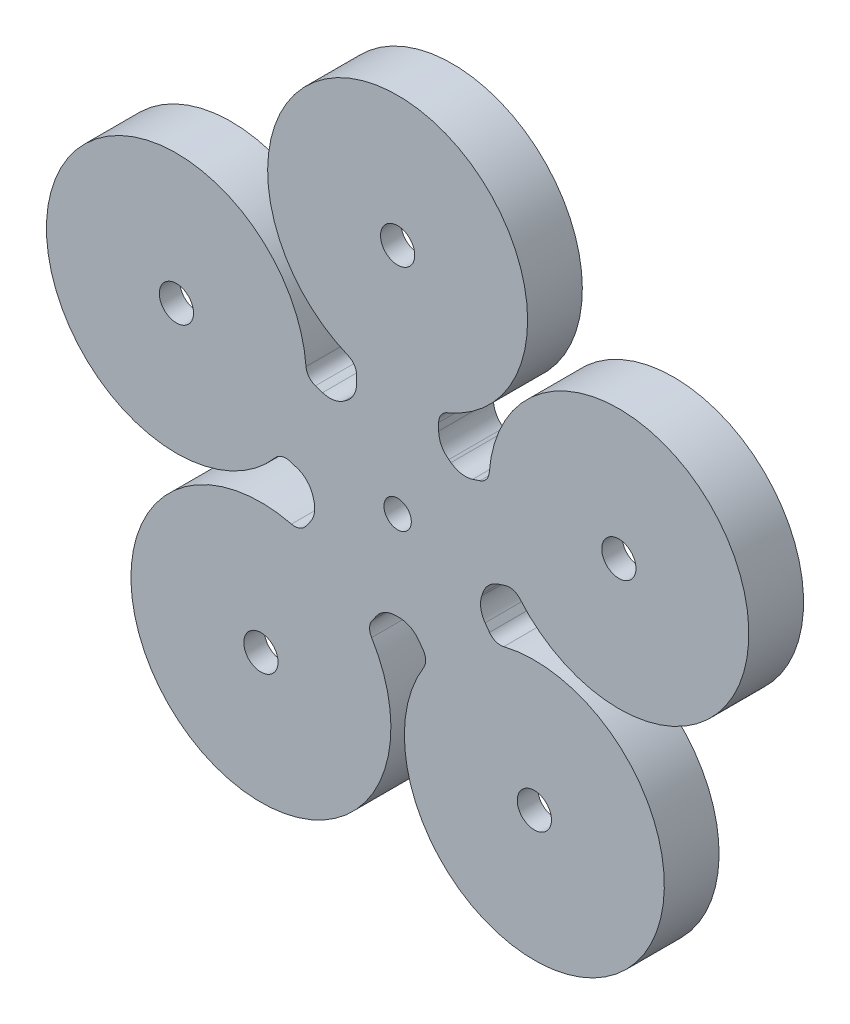
from build123d import *

# Parameters (mm, degrees)
SKETCH1_R               = 13
BOSS_EXTRUDE1_DEPTH     = 120
CUT_EXTRUDE3_DEPTH      = 53
CUT_EXTRUDE3_DEPTH_BACK = 110
SKETCH2_2_R             = 55
BOSS_EXTRUDE3_DEPTH     = 3
CUT_EXTRUDE4_DEPTH      = 75.460572398
BOSS_EXTRUDE4_DEPTH     = 5
CUT_EXTRUDE5_DEPTH      = 75.218440039
CUT_EXTRUDE5_DEPTH_BACK = 75.218440039
SKETCH8_R               = 2
SKETCH8_R_2             = 2.5


with BuildPart() as part:
    # Sketch1 → Boss-Extrude1 (new body)
    with BuildSketch(Plane.XY):
        with BuildLine():
            Line((8.145449953, 5.801003797), (16.461844151, 8.503164074))
            ThreePointArc((16.461844151, 8.503164074), (47.552825815, 15.450849719), (18.315946117, 2.796824976))
            Line((18.315946117, 2.796824976), (9.99955192, 0.094664699))
            ThreePointArc((9.99955192, 0.094664699), (9.510565163, -3.090169944), (8.034164925, -5.954174499))
            Line((8.034164925, -5.954174499), (13.173979203, -13.028521945))
            ThreePointArc((13.173979203, -13.028521945), (29.389262615, -40.450849719), (8.319877236, -16.555233459))
            Line((8.319877236, -16.555233459), (3.180062959, -9.480886012))
            ThreePointArc((3.180062959, -9.480886012), (0, -10), (-3.180062959, -9.480886012))
            Line((-3.180062959, -9.480886012), (-8.319877236, -16.555233459))
            ThreePointArc((-8.319877236, -16.555233459), (-29.389262615, -40.450849719), (-13.173979203, -13.028521945))
            Line((-13.173979203, -13.028521945), (-8.034164925, -5.954174499))
            ThreePointArc((-8.034164925, -5.954174499), (-9.510565163, -3.090169944), (-9.99955192, 0.094664699))
            Line((-9.99955192, 0.094664699), (-18.315946117, 2.796824976))
            ThreePointArc((-18.315946117, 2.796824976), (-47.552825815, 15.450849719), (-16.461844151, 8.503164074))
            Line((-16.461844151, 8.503164074), (-8.145449953, 5.801003797))
            ThreePointArc((-8.145449953, 5.801003797), (-5.877852523, 8.090169944), (-3, 9.539392014))
            Line((-3, 9.539392014), (-3, 18.283766354))
            ThreePointArc((-3, 18.283766354), (0, 50), (3, 18.283766354))
            Line((3, 18.283766354), (3, 9.539392014))
            ThreePointArc((3, 9.539392014), (5.877852523, 8.090169944), (8.145449953, 5.801003797))
        make_face()
        with Locations((0, 34)):
            Circle(SKETCH1_R, mode=Mode.SUBTRACT)
        with Locations((32.335921554, 10.506577809)):
            Circle(SKETCH1_R, mode=Mode.SUBTRACT)
        with Locations((19.984698578, -27.506577809)):
            Circle(SKETCH1_R, mode=Mode.SUBTRACT)
        with Locations((-19.984698578, -27.506577809)):
            Circle(SKETCH1_R, mode=Mode.SUBTRACT)
        with Locations((-32.335921554, 10.506577809)):
            Circle(SKETCH1_R, mode=Mode.SUBTRACT)
    extrude(amount=BOSS_EXTRUDE1_DEPTH)

    # Sketch2<2> → Cut-Extrude3 (cut, two sides: drawn at the far end of the back side and taken through both)
    with BuildSketch(Plane(origin=(0, 0, 0), x_dir=(-1, 0, 0), z_dir=(0, 0, -1)).offset(-CUT_EXTRUDE3_DEPTH_BACK)):
        Circle(SKETCH2_2_R)
    extrude(amount=CUT_EXTRUDE3_DEPTH + CUT_EXTRUDE3_DEPTH_BACK, mode=Mode.SUBTRACT)

    # Sketch6 → Boss-Extrude3 (add)
    with BuildSketch(Plane(origin=(0, 0, 110), x_dir=(-1, 0, 0), z_dir=(0, 0, -1))):
        with BuildLine():
            Line((-15.723846237, -1.199786002), (-14.684555835, -1.537471924))
            ThreePointArc((-14.684555835, -1.537471924), (-13.273010033, -2.409662852), (-12.421787824, -3.833951909))
            ThreePointArc((-12.421787824, -3.833951909), (-12.363734712, -4.017220927), (-12.302977841, -4.19961144))
            ThreePointArc((-12.302977841, -4.19961144), (-12.15445497, -5.852221353), (-12.783758548, -7.387524442))
            Line((-12.783758548, -7.387524442), (-13.426075341, -8.271597662))
            ThreePointArc((-13.426075341, -8.271597662), (-14.353632706, -8.973057267), (-15.514641639, -9.039889124))
            ThreePointArc((-15.514641639, -9.039889124), (-31.152618372, -42.877900702), (-3.80315753, -17.548780396))
            ThreePointArc((-3.80315753, -17.548780396), (-4.098368148, -16.423943104), (-3.717871409, -15.32502069))
            Line((-3.717871409, -15.32502069), (-3.075554616, -14.440947469))
            ThreePointArc((-3.075554616, -14.440947469), (-1.809860109, -13.368009454), (-0.192238592, -12.99857855))
            ThreePointArc((-0.192238592, -12.99857855), (0, -13), (0.192238592, -12.99857855))
            ThreePointArc((0.192238592, -12.99857855), (1.809860109, -13.368009454), (3.075554616, -14.440947469))
            Line((3.075554616, -14.440947469), (3.717871409, -15.32502069))
            ThreePointArc((3.717871409, -15.32502069), (4.098368148, -16.423943104), (3.80315753, -17.548780396))
            ThreePointArc((3.80315753, -17.548780396), (31.152618372, -42.877900702), (15.514641639, -9.039889124))
            ThreePointArc((15.514641639, -9.039889124), (14.353632706, -8.973057267), (13.426075341, -8.271597662))
            Line((13.426075341, -8.271597662), (12.783758548, -7.387524442))
            ThreePointArc((12.783758548, -7.387524442), (12.15445497, -5.852221353), (12.302977841, -4.19961144))
            ThreePointArc((12.302977841, -4.19961144), (12.363734712, -4.017220927), (12.421787824, -3.833951909))
            ThreePointArc((12.421787824, -3.833951909), (13.273010033, -2.409662852), (14.684555835, -1.537471924))
            Line((14.684555835, -1.537471924), (15.723846237, -1.199786002))
            ThreePointArc((15.723846237, -1.199786002), (16.886563519, -1.177497801), (17.865122257, -1.805853621))
            ThreePointArc((17.865122257, -1.805853621), (50.405995364, 16.377900702), (13.391733387, 11.961821662))
            ThreePointArc((13.391733387, 11.961821662), (12.969401022, 10.87828873), (12.015642305, 10.212892193))
            Line((12.015642305, 10.212892193), (10.976351903, 9.875206271))
            ThreePointArc((10.976351903, 9.875206271), (9.321726396, 9.751137749), (7.79589706, 10.403075941))
            ThreePointArc((7.79589706, 10.403075941), (7.64120828, 10.517220927), (7.484848485, 10.629065959))
            ThreePointArc((7.484848485, 10.629065959), (6.393311224, 11.878755911), (6, 13.490737563))
            Line((6, 13.490737563), (6, 14.583512161))
            ThreePointArc((6, 14.583512161), (6.33810206, 15.696209442), (7.238095238, 16.432701479))
            ThreePointArc((7.238095238, 16.432701479), (0, 53), (-7.238095238, 16.432701479))
            ThreePointArc((-7.238095238, 16.432701479), (-6.33810206, 15.696209442), (-6, 14.583512161))
            Line((-6, 14.583512161), (-6, 13.490737563))
            ThreePointArc((-6, 13.490737563), (-6.393311224, 11.878755911), (-7.484848485, 10.629065959))
            ThreePointArc((-7.484848485, 10.629065959), (-7.64120828, 10.517220927), (-7.79589706, 10.403075941))
            ThreePointArc((-7.79589706, 10.403075941), (-9.321726396, 9.751137749), (-10.976351903, 9.875206271))
            Line((-10.976351903, 9.875206271), (-12.015642305, 10.212892193))
            ThreePointArc((-12.015642305, 10.212892193), (-12.969401022, 10.87828873), (-13.391733387, 11.961821662))
            ThreePointArc((-13.391733387, 11.961821662), (-50.405995364, 16.377900702), (-17.865122257, -1.805853621))
            ThreePointArc((-17.865122257, -1.805853621), (-16.886563519, -1.177497801), (-15.723846237, -1.199786002))
        make_face()
    extrude(amount=BOSS_EXTRUDE3_DEPTH)

    # Sketch6<2> → Cut-Extrude4 (cut, through all)
    with BuildSketch(Plane(origin=(0, 0, 110), x_dir=(-1, 0, 0), z_dir=(0, 0, -1))):
        with BuildLine():
            Line((-15.723846237, -1.199786002), (-14.684555835, -1.537471924))
            ThreePointArc((-14.684555835, -1.537471924), (-13.273010033, -2.409662852), (-12.421787824, -3.833951909))
            ThreePointArc((-12.421787824, -3.833951909), (-12.363734712, -4.017220927), (-12.302977841, -4.19961144))
            ThreePointArc((-12.302977841, -4.19961144), (-12.15445497, -5.852221353), (-12.783758548, -7.387524442))
            Line((-12.783758548, -7.387524442), (-13.426075341, -8.271597662))
            ThreePointArc((-13.426075341, -8.271597662), (-14.353632706, -8.973057267), (-15.514641639, -9.039889124))
            ThreePointArc((-15.514641639, -9.039889124), (-31.152618372, -42.877900702), (-3.80315753, -17.548780396))
            ThreePointArc((-3.80315753, -17.548780396), (-4.098368148, -16.423943104), (-3.717871409, -15.32502069))
            Line((-3.717871409, -15.32502069), (-3.075554616, -14.440947469))
            ThreePointArc((-3.075554616, -14.440947469), (-1.809860109, -13.368009454), (-0.192238592, -12.99857855))
            ThreePointArc((-0.192238592, -12.99857855), (0, -13), (0.192238592, -12.99857855))
            ThreePointArc((0.192238592, -12.99857855), (1.809860109, -13.368009454), (3.075554616, -14.440947469))
            Line((3.075554616, -14.440947469), (3.717871409, -15.32502069))
            ThreePointArc((3.717871409, -15.32502069), (4.098368148, -16.423943104), (3.80315753, -17.548780396))
            ThreePointArc((3.80315753, -17.548780396), (31.152618372, -42.877900702), (15.514641639, -9.039889124))
            ThreePointArc((15.514641639, -9.039889124), (14.353632706, -8.973057267), (13.426075341, -8.271597662))
            Line((13.426075341, -8.271597662), (12.783758548, -7.387524442))
            ThreePointArc((12.783758548, -7.387524442), (12.15445497, -5.852221353), (12.302977841, -4.19961144))
            ThreePointArc((12.302977841, -4.19961144), (12.363734712, -4.017220927), (12.421787824, -3.833951909))
            ThreePointArc((12.421787824, -3.833951909), (13.273010033, -2.409662852), (14.684555835, -1.537471924))
            Line((14.684555835, -1.537471924), (15.723846237, -1.199786002))
            ThreePointArc((15.723846237, -1.199786002), (16.886563519, -1.177497801), (17.865122257, -1.805853621))
            ThreePointArc((17.865122257, -1.805853621), (50.405995364, 16.377900702), (13.391733387, 11.961821662))
            ThreePointArc((13.391733387, 11.961821662), (12.969401022, 10.87828873), (12.015642305, 10.212892193))
            Line((12.015642305, 10.212892193), (10.976351903, 9.875206271))
            ThreePointArc((10.976351903, 9.875206271), (9.321726396, 9.751137749), (7.79589706, 10.403075941))
            ThreePointArc((7.79589706, 10.403075941), (7.64120828, 10.517220927), (7.484848485, 10.629065959))
            ThreePointArc((7.484848485, 10.629065959), (6.393311224, 11.878755911), (6, 13.490737563))
            Line((6, 13.490737563), (6, 14.583512161))
            ThreePointArc((6, 14.583512161), (6.33810206, 15.696209442), (7.238095238, 16.432701479))
            ThreePointArc((7.238095238, 16.432701479), (0, 53), (-7.238095238, 16.432701479))
            ThreePointArc((-7.238095238, 16.432701479), (-6.33810206, 15.696209442), (-6, 14.583512161))
            Line((-6, 14.583512161), (-6, 13.490737563))
            ThreePointArc((-6, 13.490737563), (-6.393311224, 11.878755911), (-7.484848485, 10.629065959))
            ThreePointArc((-7.484848485, 10.629065959), (-7.64120828, 10.517220927), (-7.79589706, 10.403075941))
            ThreePointArc((-7.79589706, 10.403075941), (-9.321726396, 9.751137749), (-10.976351903, 9.875206271))
            Line((-10.976351903, 9.875206271), (-12.015642305, 10.212892193))
            ThreePointArc((-12.015642305, 10.212892193), (-12.969401022, 10.87828873), (-13.391733387, 11.961821662))
            ThreePointArc((-13.391733387, 11.961821662), (-50.405995364, 16.377900702), (-17.865122257, -1.805853621))
            ThreePointArc((-17.865122257, -1.805853621), (-16.886563519, -1.177497801), (-15.723846237, -1.199786002))
        make_face()
    extrude(amount=-CUT_EXTRUDE4_DEPTH, mode=Mode.SUBTRACT)

    # Sketch7 → Boss-Extrude4 (add)
    with BuildSketch(Plane(origin=(0, 0, 107), x_dir=(-1, 0, 0), z_dir=(0, 0, -1))):
        with BuildLine():
            Line((-10.976351903, 9.875206271), (-12.015642305, 10.212892193))
            ThreePointArc((-12.015642305, 10.212892193), (-12.969401022, 10.87828873), (-13.391733387, 11.961821662))
            ThreePointArc((-13.391733387, 11.961821662), (-50.405995364, 16.377900702), (-17.865122257, -1.805853621))
            ThreePointArc((-17.865122257, -1.805853621), (-16.886563519, -1.177497801), (-15.723846237, -1.199786002))
            Line((-15.723846237, -1.199786002), (-14.684555835, -1.537471924))
            ThreePointArc((-14.684555835, -1.537471924), (-13.273010033, -2.409662852), (-12.421787824, -3.833951909))
            ThreePointArc((-12.421787824, -3.833951909), (-12.363734712, -4.017220927), (-12.302977841, -4.19961144))
            ThreePointArc((-12.302977841, -4.19961144), (-12.15445497, -5.852221353), (-12.783758548, -7.387524442))
            Line((-12.783758548, -7.387524442), (-13.426075341, -8.271597662))
            ThreePointArc((-13.426075341, -8.271597662), (-14.353632706, -8.973057267), (-15.514641639, -9.039889124))
            ThreePointArc((-15.514641639, -9.039889124), (-31.152618372, -42.877900702), (-3.80315753, -17.548780396))
            ThreePointArc((-3.80315753, -17.548780396), (-4.098368148, -16.423943104), (-3.717871409, -15.32502069))
            Line((-3.717871409, -15.32502069), (-3.075554616, -14.440947469))
            ThreePointArc((-3.075554616, -14.440947469), (-1.809860109, -13.368009454), (-0.192238592, -12.99857855))
            ThreePointArc((-0.192238592, -12.99857855), (0, -13), (0.192238592, -12.99857855))
            ThreePointArc((0.192238592, -12.99857855), (1.809860109, -13.368009454), (3.075554616, -14.440947469))
            Line((3.075554616, -14.440947469), (3.717871409, -15.32502069))
            ThreePointArc((3.717871409, -15.32502069), (4.098368148, -16.423943104), (3.80315753, -17.548780396))
            ThreePointArc((3.80315753, -17.548780396), (31.152618372, -42.877900702), (15.514641639, -9.039889124))
            ThreePointArc((15.514641639, -9.039889124), (14.353632706, -8.973057267), (13.426075341, -8.271597662))
            Line((13.426075341, -8.271597662), (12.783758548, -7.387524442))
            ThreePointArc((12.783758548, -7.387524442), (12.15445497, -5.852221353), (12.302977841, -4.19961144))
            ThreePointArc((12.302977841, -4.19961144), (12.363734712, -4.017220927), (12.421787824, -3.833951909))
            ThreePointArc((12.421787824, -3.833951909), (13.273010033, -2.409662852), (14.684555835, -1.537471924))
            Line((14.684555835, -1.537471924), (15.723846237, -1.199786002))
            ThreePointArc((15.723846237, -1.199786002), (16.886563519, -1.177497801), (17.865122257, -1.805853621))
            ThreePointArc((17.865122257, -1.805853621), (50.405995364, 16.377900702), (13.391733387, 11.961821662))
            ThreePointArc((13.391733387, 11.961821662), (12.969401022, 10.87828873), (12.015642305, 10.212892193))
            Line((12.015642305, 10.212892193), (10.976351903, 9.875206271))
            ThreePointArc((10.976351903, 9.875206271), (9.321726396, 9.751137749), (7.79589706, 10.403075941))
            ThreePointArc((7.79589706, 10.403075941), (7.64120828, 10.517220927), (7.484848485, 10.629065959))
            ThreePointArc((7.484848485, 10.629065959), (6.393311224, 11.878755911), (6, 13.490737563))
            Line((6, 13.490737563), (6, 14.583512161))
            ThreePointArc((6, 14.583512161), (6.33810206, 15.696209442), (7.238095238, 16.432701479))
            ThreePointArc((7.238095238, 16.432701479), (0, 53), (-7.238095238, 16.432701479))
            ThreePointArc((-7.238095238, 16.432701479), (-6.33810206, 15.696209442), (-6, 14.583512161))
            Line((-6, 14.583512161), (-6, 13.490737563))
            ThreePointArc((-6, 13.490737563), (-6.393311224, 11.878755911), (-7.484848485, 10.629065959))
            ThreePointArc((-7.484848485, 10.629065959), (-7.64120828, 10.517220927), (-7.79589706, 10.403075941))
            ThreePointArc((-7.79589706, 10.403075941), (-9.321726396, 9.751137749), (-10.976351903, 9.875206271))
        make_face()
        with BuildLine():
            Line((-6.144922392, -13.561664933), (-5.502605599, -12.677591712))
            ThreePointArc((-5.502605599, -12.677591712), (-3.152030087, -10.684992542), (-0.14787584, -9.998906577))
            ThreePointArc((-0.14787584, -9.998906577), (0, -10), (0.14787584, -9.998906577))
            ThreePointArc((0.14787584, -9.998906577), (3.152030087, -10.684992542), (5.502605599, -12.677591712))
            Line((5.502605599, -12.677591712), (6.144922392, -13.561664933))
            ThreePointArc((6.144922392, -13.561664933), (7.09616424, -16.308970969), (6.358137696, -19.121064198))
            ThreePointArc((6.358137696, -19.121064198), (29.389262615, -40.450849719), (16.220440103, -11.955682075))
            ThreePointArc((16.220440103, -11.955682075), (13.317917769, -11.788602431), (10.999024358, -10.034953419))
            Line((10.999024358, -10.034953419), (10.356707565, -9.150880198))
            ThreePointArc((10.356707565, -9.150880198), (9.18800092, -6.299603034), (9.463829108, -3.230470339))
            ThreePointArc((9.463829108, -3.230470339), (9.510565163, -3.090169944), (9.555221403, -2.949193776))
            ThreePointArc((9.555221403, -2.949193776), (11.136062647, -0.304085527), (13.757504852, 1.315697625))
            Line((13.757504852, 1.315697625), (14.796795254, 1.653383547))
            ThreePointArc((14.796795254, 1.653383547), (17.703588459, 1.709104051), (20.149985304, 0.138214499))
            ThreePointArc((20.149985304, 0.138214499), (47.552825815, 15.450849719), (16.382920992, 11.732046317))
            ThreePointArc((16.382920992, 11.732046317), (15.32709008, 9.023213987), (12.942693288, 7.359722644))
            Line((12.942693288, 7.359722644), (11.903402886, 7.022036723))
            ThreePointArc((11.903402886, 7.022036723), (8.830526944, 6.791623752), (5.996843892, 8.002366108))
            ThreePointArc((5.996843892, 8.002366108), (5.877852523, 8.090169944), (5.757575758, 8.176204584))
            ThreePointArc((5.757575758, 8.176204584), (3.73043513, 10.497057351), (3, 13.490737563))
            Line((3, 13.490737563), (3, 14.583512161))
            ThreePointArc((3, 14.583512161), (3.845255151, 17.365255362), (6.095238095, 19.206485456))
            ThreePointArc((6.095238095, 19.206485456), (0, 50), (-6.095238095, 19.206485456))
            ThreePointArc((-6.095238095, 19.206485456), (-3.845255151, 17.365255362), (-3, 14.583512161))
            Line((-3, 14.583512161), (-3, 13.490737563))
            ThreePointArc((-3, 13.490737563), (-3.73043513, 10.497057351), (-5.757575758, 8.176204584))
            ThreePointArc((-5.757575758, 8.176204584), (-5.877852523, 8.090169944), (-5.996843892, 8.002366108))
            ThreePointArc((-5.996843892, 8.002366108), (-8.830526944, 6.791623752), (-11.903402886, 7.022036723))
            Line((-11.903402886, 7.022036723), (-12.942693288, 7.359722644))
            ThreePointArc((-12.942693288, 7.359722644), (-15.32709008, 9.023213987), (-16.382920992, 11.732046317))
            ThreePointArc((-16.382920992, 11.732046317), (-47.552825815, 15.450849719), (-20.149985304, 0.138214499))
            ThreePointArc((-20.149985304, 0.138214499), (-17.703588459, 1.709104051), (-14.796795254, 1.653383547))
            Line((-14.796795254, 1.653383547), (-13.757504852, 1.315697625))
            ThreePointArc((-13.757504852, 1.315697625), (-11.136062647, -0.304085527), (-9.555221403, -2.949193776))
            ThreePointArc((-9.555221403, -2.949193776), (-9.510565163, -3.090169944), (-9.463829108, -3.230470339))
            ThreePointArc((-9.463829108, -3.230470339), (-9.18800092, -6.299603034), (-10.356707565, -9.150880198))
            Line((-10.356707565, -9.150880198), (-10.999024358, -10.034953419))
            ThreePointArc((-10.999024358, -10.034953419), (-13.317917769, -11.788602431), (-16.220440103, -11.955682075))
            ThreePointArc((-16.220440103, -11.955682075), (-29.389262615, -40.450849719), (-6.358137696, -19.121064198))
            ThreePointArc((-6.358137696, -19.121064198), (-7.09616424, -16.308970969), (-6.144922392, -13.561664933))
        make_face(mode=Mode.SUBTRACT)
    extrude(amount=BOSS_EXTRUDE4_DEPTH)

    # Sketch8 → Cut-Extrude5 (cut, two sides: drawn at the far end of the back side and taken through both)
    with BuildSketch(Plane.XY.offset(110).offset(-CUT_EXTRUDE5_DEPTH_BACK)):
        Circle(SKETCH8_R)
        with Locations((0, 34)):
            Circle(SKETCH8_R_2)
        with Locations((32.335921554, 10.506577809)):
            Circle(SKETCH8_R_2)
        with Locations((19.984698578, -27.506577809)):
            Circle(SKETCH8_R_2)
        with Locations((-19.984698578, -27.506577809)):
            Circle(SKETCH8_R_2)
        with Locations((-32.335921554, 10.506577809)):
            Circle(SKETCH8_R_2)
    extrude(amount=CUT_EXTRUDE5_DEPTH + CUT_EXTRUDE5_DEPTH_BACK, mode=Mode.SUBTRACT)


solid = part.part
